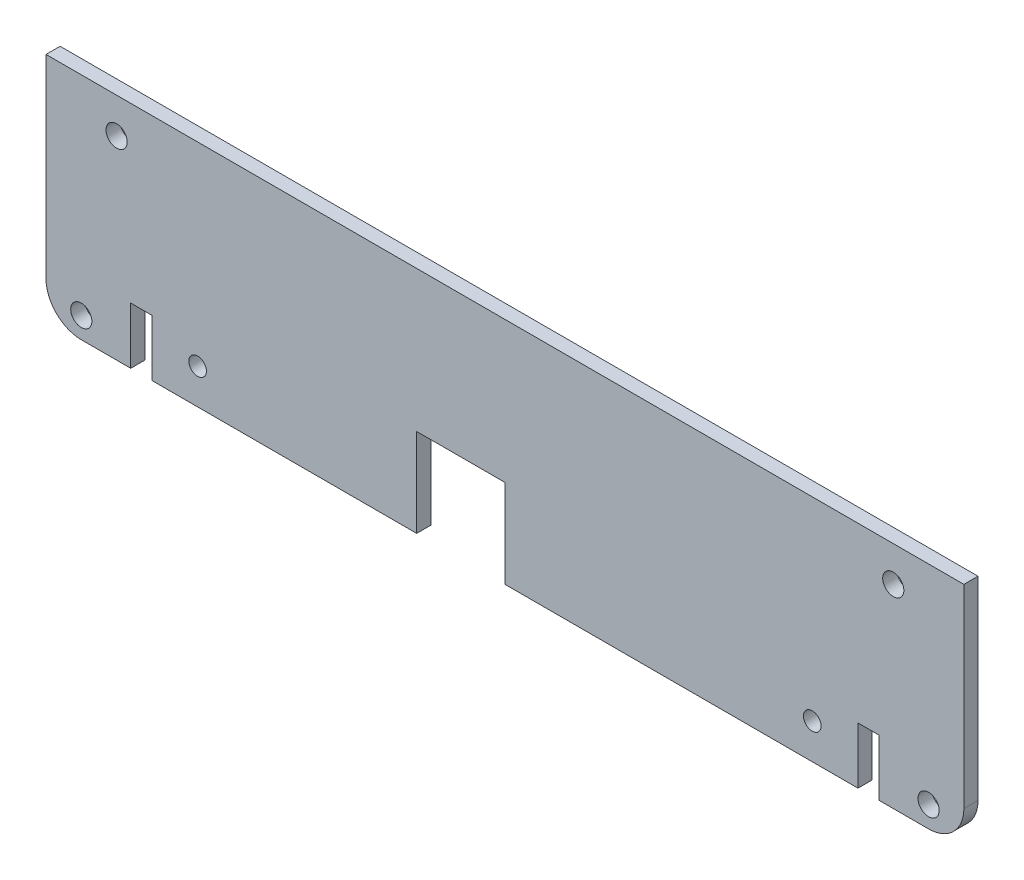
from build123d import *

# Parameters (mm, degrees)
SKETCH1_W           = 260
SKETCH1_H           = 65
BOSS_EXTRUDE2_DEPTH = 4
SKETCH3_R           = 3
CUT_EXTRUDE2_DEPTH  = 135.060620616
FILLET1_R           = 10
SKETCH4_W           = 25
SKETCH4_H           = 25
CUT_EXTRUDE3_DEPTH  = 10
SKETCH5_W           = 6
SKETCH5_H           = 16
CUT_EXTRUDE4_DEPTH  = 135.060620616
SKETCH6_R           = 2.5
CUT_EXTRUDE5_DEPTH  = 135.060620616


with BuildPart() as part:
    # Sketch1 → Boss-Extrude2 (new body)
    with BuildSketch(Plane.XY):
        Rectangle(SKETCH1_W, SKETCH1_H)
    extrude(amount=BOSS_EXTRUDE2_DEPTH)

    # Sketch3 → Cut-Extrude2 (cut, through all)
    with BuildSketch(Plane(origin=(0, 0, 0), x_dir=(-1, 0, 0), z_dir=(0, 0, -1))):
        with Locations((120, -26.5)):
            Circle(SKETCH3_R)
        with Locations((-120, -26.5)):
            Circle(SKETCH3_R)
        with Locations((-110, 22.5)):
            Circle(SKETCH3_R)
        with Locations((110, 22.5)):
            Circle(SKETCH3_R)
    extrude(amount=-CUT_EXTRUDE2_DEPTH, mode=Mode.SUBTRACT)

    # Fillet1
    fillet1_edges = [part.edges().sort_by_distance(p)[0] for p in [
        (130, -32.5, 2),
        (-130, -32.5, 2),
    ]]
    fillet(fillet1_edges, radius=FILLET1_R)

    # Sketch4 → Cut-Extrude3 (cut)
    with BuildSketch(Plane(origin=(0, 0, 0), x_dir=(-1, 0, 0), z_dir=(0, 0, -1))):
        with Locations((12.5, -20)):
            Rectangle(SKETCH4_W, SKETCH4_H)
    extrude(amount=-CUT_EXTRUDE3_DEPTH, mode=Mode.SUBTRACT)

    # Sketch5 → Cut-Extrude4 (cut, through all)
    with BuildSketch(Plane(origin=(0, 0, 0), x_dir=(-1, 0, 0), z_dir=(0, 0, -1))):
        with Locations((-103, -24.5)):
            Rectangle(SKETCH5_W, SKETCH5_H)
        with Locations((103, -24.5)):
            Rectangle(SKETCH5_W, SKETCH5_H)
    extrude(amount=-CUT_EXTRUDE4_DEPTH, mode=Mode.SUBTRACT)

    # Sketch6 → Cut-Extrude5 (cut, through all)
    with BuildSketch(Plane(origin=(0, 0, 0), x_dir=(-1, 0, 0), z_dir=(0, 0, -1))):
        with Locations((87.05, -22.5)):
            Circle(SKETCH6_R)
        with Locations((-87.05, -22.5)):
            Circle(SKETCH6_R)
    extrude(amount=-CUT_EXTRUDE5_DEPTH, mode=Mode.SUBTRACT)


solid = part.part
